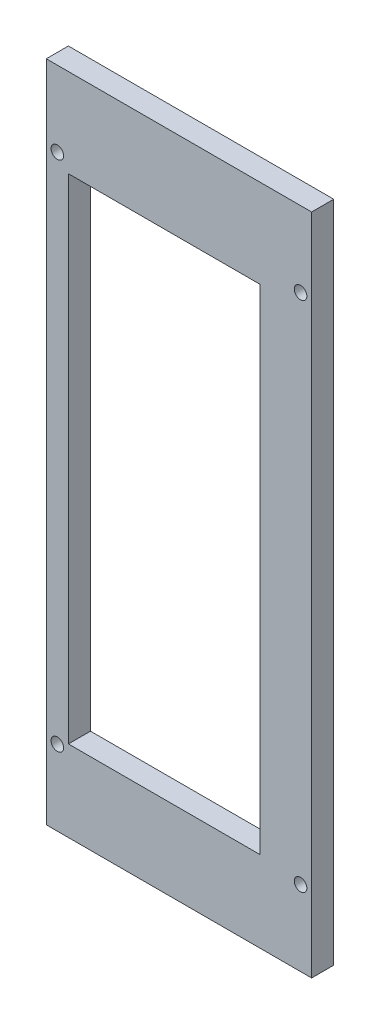
from build123d import *

# Parameters (mm, degrees)
SKETCH1_W           = 36
SKETCH1_H           = 90
SKETCH1_W_2         = 30
SKETCH1_H_2         = 67
BOSS_EXTRUDE1_DEPTH = 3
SKETCH3_R           = 0.85
CUT_EXTRUDE1_DEPTH  = 3
SKETCH4_W           = 4
SKETCH4_H           = 67
BOSS_EXTRUDE2_DEPTH = 3


with BuildPart() as part:
    # Sketch1 → Boss-Extrude1 (new body)
    with BuildSketch(Plane.XY):
        with Locations((18, -51.003070917)):
            Rectangle(SKETCH1_W, SKETCH1_H)
        with Locations((18, -51.503070917)):
            Rectangle(SKETCH1_W_2, SKETCH1_H_2, mode=Mode.SUBTRACT)
    extrude(amount=BOSS_EXTRUDE1_DEPTH)

    # Sketch3 → Cut-Extrude1 (cut)
    with BuildSketch(Plane(origin=(0, 0, 0), x_dir=(-1, 0, 0), z_dir=(0, 0, -1))):
        with Locations((-34.5, -16.224619538)):
            Circle(SKETCH3_R)
        with Locations((-1.5, -16.224619538)):
            Circle(SKETCH3_R)
        with Locations((-1.5, -85.781522297)):
            Circle(SKETCH3_R)
        with Locations((-34.5, -85.781522297)):
            Circle(SKETCH3_R)
    extrude(amount=-CUT_EXTRUDE1_DEPTH, mode=Mode.SUBTRACT)

    # Sketch4 → Boss-Extrude2 (add)
    with BuildSketch(Plane.XY.offset(3)):
        with Locations((31, -51.503070917)):
            Rectangle(SKETCH4_W, SKETCH4_H)
    extrude(amount=-BOSS_EXTRUDE2_DEPTH)


solid = part.part
